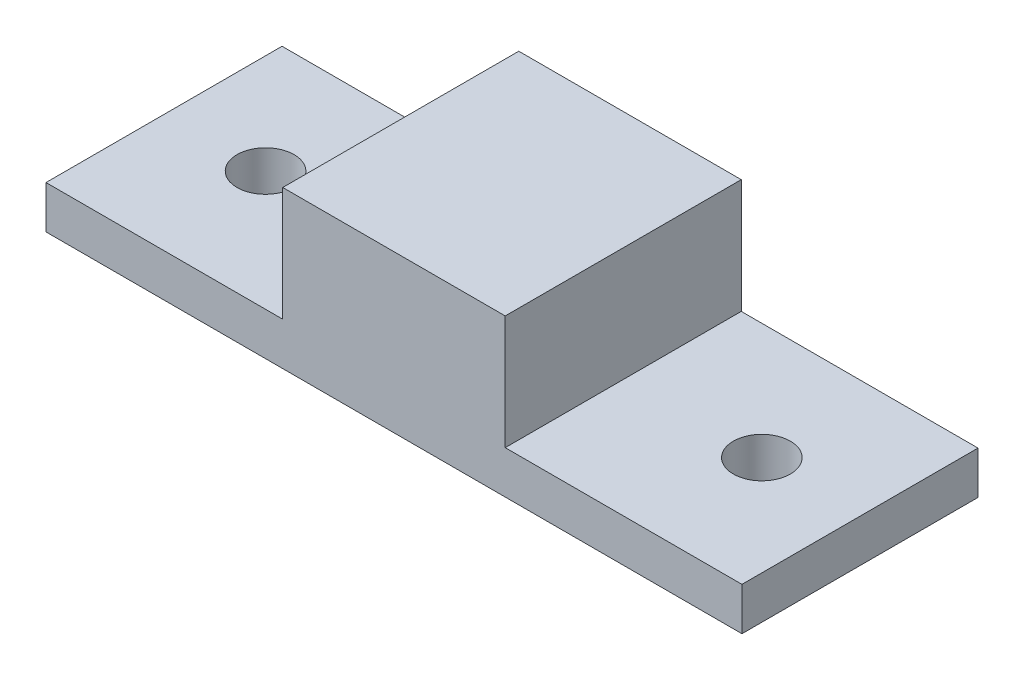
from build123d import *

# Parameters (mm, degrees)
SKETCH1_W           = 61.976
SKETCH1_H           = 21.019262
SKETCH1_R           = 2.54
BOSS_EXTRUDE1_DEPTH = 3.81
SKETCH2_W           = 19.812
SKETCH2_H           = 21.019262
BOSS_EXTRUDE2_DEPTH = 10.16


with BuildPart() as part:
    # Sketch1 → Boss-Extrude1 (new body)
    with BuildSketch(Plane(origin=(0, 0, 0), x_dir=(1, 0, 0), z_dir=(0, 1, 0))):
        with Locations((30.988, 10.509631)):
            Rectangle(SKETCH1_W, SKETCH1_H)
        with Locations(Location((8.89, 10.660974632, 0), (0, 0, 90))):
            Circle(SKETCH1_R, mode=Mode.SUBTRACT)
        with Locations(Location((53.086, 10.660974632, 0), (0, 0, 90))):
            Circle(SKETCH1_R, mode=Mode.SUBTRACT)
    extrude(amount=BOSS_EXTRUDE1_DEPTH)

    # Sketch2 → Boss-Extrude2 (add)
    with BuildSketch(Plane(origin=(0, 3.81, 0), x_dir=(1, 0, 0), z_dir=(0, 1, 0))):
        with Locations((30.988, 10.509631)):
            Rectangle(SKETCH2_W, SKETCH2_H)
    extrude(amount=BOSS_EXTRUDE2_DEPTH)


solid = part.part
